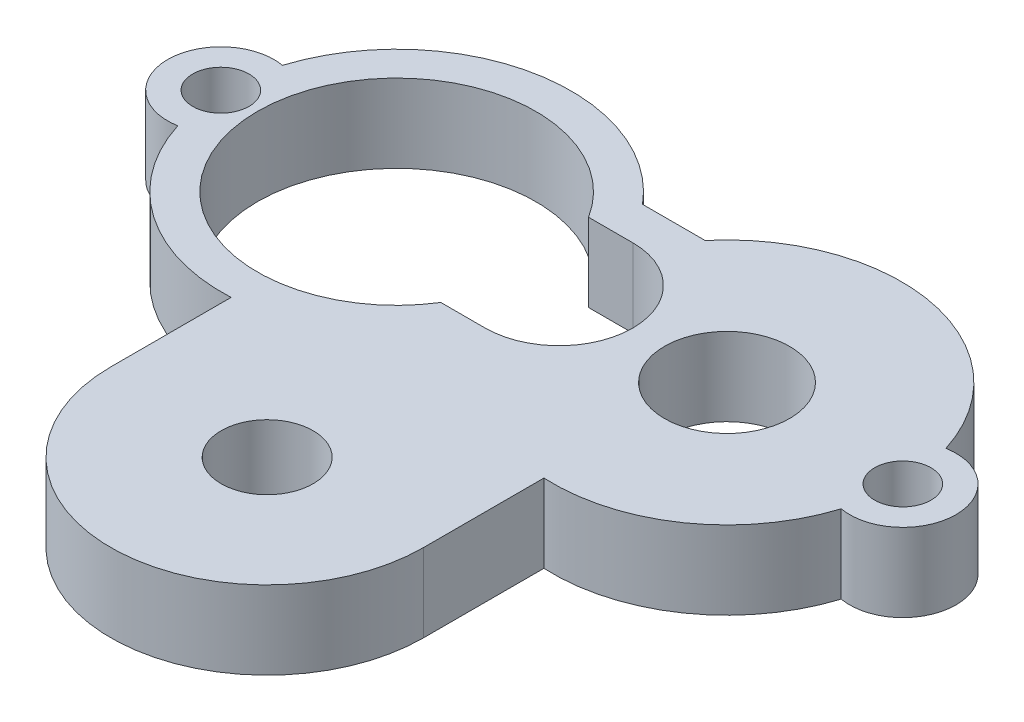
from build123d import *

# Parameters (mm, degrees)
SKETCH1_R           = 1.143
SKETCH1_R_2         = 1.8669
BOSS_EXTRUDE1_DEPTH = 3.175
SKETCH2_R           = 2.54
CUT_EXTRUDE1_DEPTH  = 26.080811969


with BuildPart() as part:
    # Sketch1 → Boss-Extrude1 (new body)
    with BuildSketch(Plane(origin=(0, 0, 0), x_dir=(1, 0, 0), z_dir=(0, 1, 0))):
        with BuildLine():
            ThreePointArc((13.466066475, 14.089241508), (16.002, 11.9634), (13.466066475, 9.837558492))
            ThreePointArc((13.466066475, 9.837558492), (10.753575803, 6.146552641), (6.35, 4.885739418))
            Line((6.35, 4.885739418), (6.35, 0))
            ThreePointArc((6.35, 0), (0, -6.35), (-6.35, 0))
            Line((-6.35, 0), (-6.35, 4.885739418))
            ThreePointArc((-6.35, 4.885739418), (-10.753575803, 6.146552641), (-13.466066475, 9.837558492))
            ThreePointArc((-13.466066475, 9.837558492), (-16.002, 11.9634), (-13.466066475, 14.089241508))
            ThreePointArc((-13.466066475, 14.089241508), (-8.085518963, 18.914398366), (-1.27, 16.51))
            Line((-1.27, 16.51), (1.27, 16.51))
            ThreePointArc((1.27, 16.51), (8.085518963, 18.914398366), (13.466066475, 14.089241508))
        make_face()
        with Locations(Location((13.843, 11.9634, 0), (0, 0, 270))):
            Circle(SKETCH1_R, mode=Mode.SUBTRACT)
        with Locations(Location((-13.843, 11.9634, 0), (0, 0, 270))):
            Circle(SKETCH1_R, mode=Mode.SUBTRACT)
        with Locations(Location((0, 0, 0), (0, 0, 270))):
            Circle(SKETCH1_R_2, mode=Mode.SUBTRACT)
    extrude(amount=BOSS_EXTRUDE1_DEPTH)

    # Sketch2 → Cut-Extrude1 (cut, through all)
    with BuildSketch(Plane(origin=(0, 3.175, 0), x_dir=(1, 0, 0), z_dir=(0, 1, 0))):
        with Locations(Location((6.705837378, 11.9634, 0), (0, 0, 270))):
            Circle(SKETCH2_R)
        with BuildLine():
            Line((-0.114537378, 8.9662), (-1.914569862, 8.9662))
            ThreePointArc((-1.914569862, 8.9662), (-12.357337378, 11.9634), (-1.914569862, 14.9606))
            Line((-1.914569862, 14.9606), (-0.114537378, 14.9606))
            ThreePointArc((-0.114537378, 14.9606), (2.882662622, 11.9634), (-0.114537378, 8.9662))
        make_face()
    extrude(amount=-CUT_EXTRUDE1_DEPTH, mode=Mode.SUBTRACT)


solid = part.part
